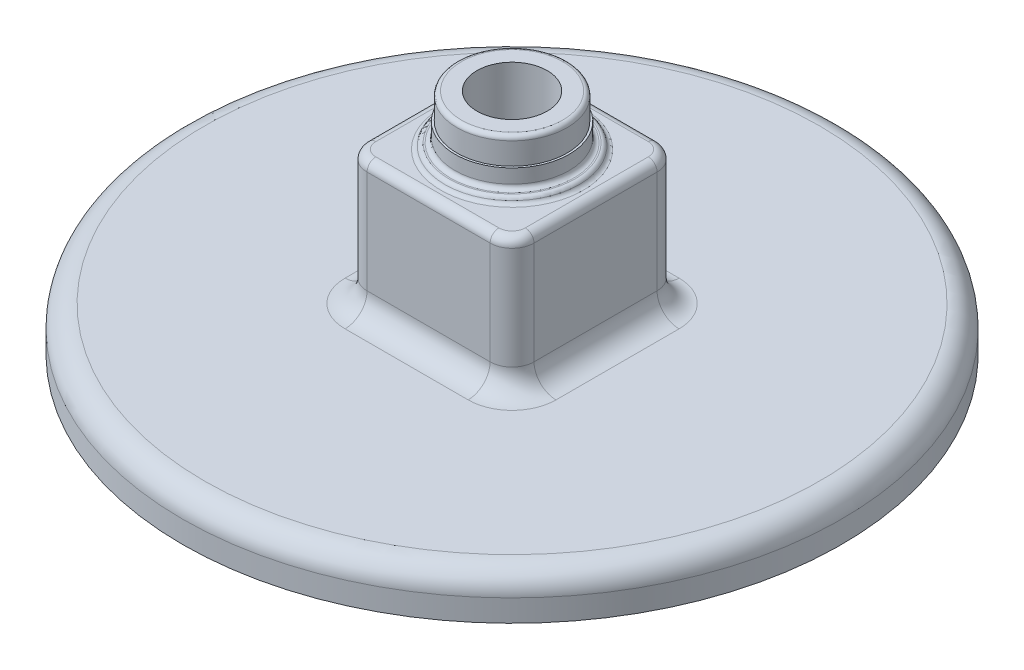
from build123d import *

# Parameters (mm, degrees)
SKETCH1_W      = 380
SKETCH1_H      = 380
EXTRUDE1_DEPTH = 404
SKETCH4_R      = 750
EXTRUDE2_DEPTH = 100
FILLET1_R      = 50
FILLET2_R      = 50
FILLET3_R      = 50
FILLET4_R      = 20
FILLET5_R      = 10
FILLET6_R      = 10
FILLET7_R      = 10
SCALE1_SCALE   = 0.1


with BuildPart() as part:
    # Sketch1 → Extrude1 (new body)
    with BuildSketch(Plane(origin=(0, 0, 0), x_dir=(1, 0, 0), z_dir=(0, 1, 0))):
        Rectangle(SKETCH1_W, SKETCH1_H)
    extrude(amount=EXTRUDE1_DEPTH)

    # Sketch4 → Extrude2 (add)
    with BuildSketch(Plane(origin=(0, 0, 0), x_dir=(1, 0, 0), z_dir=(0, 1, 0))):
        with Locations(Location((0, 0, 0), (0, 0, 270))):
            Circle(SKETCH4_R)
    extrude(amount=EXTRUDE2_DEPTH)

    # Fillet1
    fillet1_edges = [part.edges().sort_by_distance(p)[0] for p in [
        (190, 252, 190),
        (-190, 252, 190),
        (-190, 252, -190),
        (190, 252, -190),
    ]]
    fillet(fillet1_edges, radius=FILLET1_R)

    # Sketch2 → Revolve1 (revolve)
    with BuildSketch(Plane(origin=(0, 0, 0), x_dir=(0, 0, -1), z_dir=(1, 0, 0))):
        Polygon((125.25, 459), (130, 459), (130, 417), (152, 417), (152, 404), (0, 404), (0, 519), (125.25, 519), align=None)
    revolve(axis=Axis((0, 0, 0), (0, 1, 0)))

    # Sketch3 → Cut-Revolve1 (revolve, cut)
    with BuildSketch(Plane(origin=(0, 0, 0), x_dir=(0, 0, -1), z_dir=(1, 0, 0))):
        Polygon((0, 519), (80, 519), (80, 269), (17.5, 269), (17.5, 169), (40, 169), (40, 0), (0, 0), align=None)
    revolve(axis=Axis((0, 0, 0), (0, 1, 0)), mode=Mode.SUBTRACT)

    # Fillet2
    fillet2_edges = [part.edges().sort_by_distance(p)[0] for p in [
        (0, 100, -750),
    ]]
    fillet(fillet2_edges, radius=FILLET2_R)

    # Fillet3
    fillet3_edges = [part.edges().sort_by_distance(p)[0] for p in [
        (0, 100, 190),
        (-190, 100, 0),
        (0, 100, -190),
        (190, 100, 0),
        (-175.355339059, 100, 175.355339059),
        (-175.355339059, 100, -175.355339059),
        (175.355339059, 100, -175.355339059),
        (175.355339059, 100, 175.355339059),
    ]]
    fillet(fillet3_edges, radius=FILLET3_R)

    # Fillet4
    fillet4_edges = [part.edges().sort_by_distance(p)[0] for p in [
        (0, 404, 190),
        (-190, 404, 0),
        (190, 404, 0),
        (0, 404, -190),
        (175.355339059, 404, 175.355339059),
        (175.355339059, 404, -175.355339059),
        (-175.355339059, 404, -175.355339059),
        (-175.355339059, 404, 175.355339059),
    ]]
    fillet(fillet4_edges, radius=FILLET4_R)

    # Fillet5
    fillet5_edges = [part.edges().sort_by_distance(p)[0] for p in [
        (0, 519, 125.25),
    ]]
    fillet(fillet5_edges, radius=FILLET5_R)

    # Fillet6
    fillet6_edges = [part.edges().sort_by_distance(p)[0] for p in [
        (0, 404, 152),
        (0, 417, 130),
    ]]
    fillet(fillet6_edges, radius=FILLET6_R)

    # Fillet7
    fillet7_edges = [part.edges().sort_by_distance(p)[0] for p in [
        (0, 417, 152),
    ]]
    fillet(fillet7_edges, radius=FILLET7_R)


with BuildPart() as part_1:
    # Scale1: scaled about (0, 0, 0)
    add(part.part.scale(SCALE1_SCALE))


solid = part_1.part
